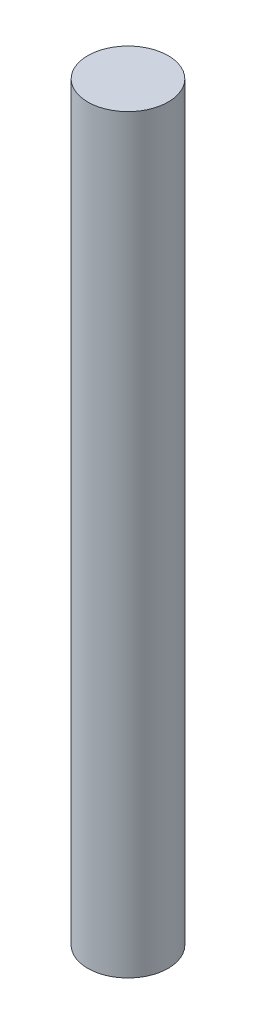
from build123d import *

# Parameters (mm, degrees)
SKETCH1_R           = 1.5
BOSS_EXTRUDE1_DEPTH = 28


with BuildPart() as part:
    # Sketch1 → Boss-Extrude1 (new body)
    with BuildSketch(Plane(origin=(0, 0, 0), x_dir=(1, 0, 0), z_dir=(0, 1, 0))):
        with Locations(Location((0, 0, 0), (0, 0, 270))):
            Circle(SKETCH1_R)
    extrude(amount=BOSS_EXTRUDE1_DEPTH)


solid = part.part
